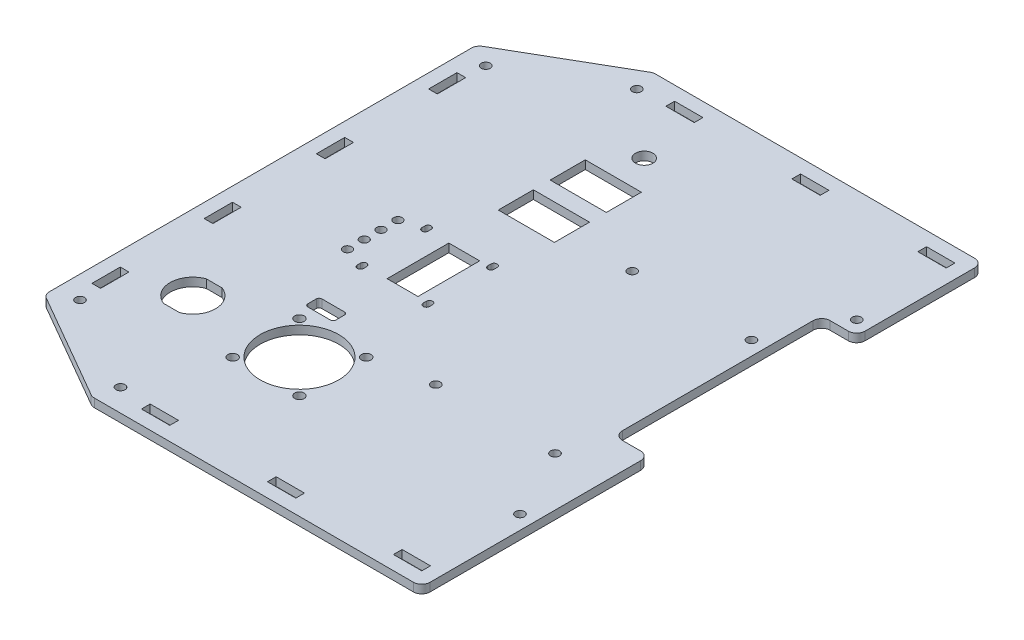
from build123d import *

# Parameters (mm, degrees)
SKETCH1_W           = 11
SKETCH1_H           = 22
BOSS_EXTRUDE1_DEPTH = 3
SKETCH5_R           = 1.6
CUT_EXTRUDE2_DEPTH  = 161.106214887
SKETCH6_W           = 10
SKETCH6_H           = 5
CUT_EXTRUDE3_DEPTH  = 161.106214887
FILLET2_R           = 1
SKETCH8_R           = 3.1
SKETCH8_W           = 20
SKETCH8_H           = 12.5
CUT_EXTRUDE5_DEPTH  = 161.106214887
CUT_EXTRUDE8_DEPTH  = 161.106214887
SKETCH12_R          = 1.55
CUT_EXTRUDE9_DEPTH  = 161.106214887
CUT_EXTRUDE10_REACH = 162.106
SKETCH13_R          = 1.6
SKETCH14_W          = 3.1
SKETCH14_H          = 10.1
CUT_EXTRUDE11_DEPTH = 161.106214887
SKETCH15_W          = 12.5
SKETCH15_H          = 74
CUT_EXTRUDE12_DEPTH = 161.106214887
FILLET3_R           = 3
SKETCH16_W          = 10.1
SKETCH16_H          = 3.1
CUT_EXTRUDE13_DEPTH = 161.106214887


with BuildPart() as part:
    # Sketch1 → Boss-Extrude1 (new body)
    with BuildSketch(Plane(origin=(0, 0, 0), x_dir=(1, 0, 0), z_dir=(0, 1, 0))):
        Polygon((32.5, -100), (32.5, 100), (-85, 100), (-125, 76.905989232), (-125, -76.905989232), (-85, -100), align=None)
        with BuildLine():
            add(Edge.make_bspline(
                [(-50.0260005, -38.958999214), (-50.026000351, -42.358999214), (-46.626000351, -42.358999065), (-46.6260005, -38.958999065), (-46.626000649, -35.558999065), (-50.026000649, -35.558999214), (-50.0260005, -38.958999214)],
                knots=[0, 0, 0, 0, 0.5, 0.5, 0.5, 1, 1, 1, 1], degree=3, weights=[1, 0.333333333, 0.333333333, 1, 0.333333333, 0.333333333, 1]))
        make_face(mode=Mode.SUBTRACT)
        with BuildLine():
            add(Edge.make_bspline(
                [(-50.02599946, -62.758999214), (-50.025999311, -66.158999214), (-46.625999311, -66.158999065), (-46.62599946, -62.758999065), (-46.625999608, -59.358999065), (-50.025999608, -59.358999214), (-50.02599946, -62.758999214)],
                knots=[0, 0, 0, 0, 0.5, 0.5, 0.5, 1, 1, 1, 1], degree=3, weights=[1, 0.333333333, 0.333333333, 1, 0.333333333, 0.333333333, 1]))
        make_face(mode=Mode.SUBTRACT)
        with BuildLine():
            add(Edge.make_bspline(
                [(-73.82599946, -62.759000254), (-73.825999311, -66.159000254), (-70.425999311, -66.159000106), (-70.42599946, -62.759000106), (-70.425999608, -59.359000106), (-73.825999608, -59.359000254), (-73.82599946, -62.759000254)],
                knots=[0, 0, 0, 0, 0.5, 0.5, 0.5, 1, 1, 1, 1], degree=3, weights=[1, 0.333333333, 0.333333333, 1, 0.333333333, 0.333333333, 1]))
        make_face(mode=Mode.SUBTRACT)
        with BuildLine():
            add(Edge.make_bspline(
                [(-73.8260005, -38.959000254), (-73.826000351, -42.359000254), (-70.426000351, -42.359000106), (-70.4260005, -38.959000106), (-70.426000649, -35.559000106), (-73.826000649, -35.559000254), (-73.8260005, -38.959000254)],
                knots=[0, 0, 0, 0, 0.5, 0.5, 0.5, 1, 1, 1, 1], degree=3, weights=[1, 0.333333333, 0.333333333, 1, 0.333333333, 0.333333333, 1]))
        make_face(mode=Mode.SUBTRACT)
        with Locations((-63.350999836, 0)):
            Rectangle(SKETCH1_W, SKETCH1_H, mode=Mode.SUBTRACT)
        with BuildLine():
            Line((-76.200999836, -12.05), (-76.200999836, -10.95))
            ThreePointArc((-76.200999836, -10.95), (-77.300999836, -9.85), (-78.400999836, -10.95))
            Line((-78.400999836, -10.95), (-78.400999836, -12.05))
            ThreePointArc((-78.400999836, -12.05), (-77.300999836, -13.15), (-76.200999836, -12.05))
        make_face(mode=Mode.SUBTRACT)
        with BuildLine():
            Line((-54.900999836, -10.95), (-54.900999836, -12.05))
            ThreePointArc((-54.900999836, -12.05), (-53.800999836, -13.15), (-52.700999836, -12.05))
            Line((-52.700999836, -12.05), (-52.700999836, -10.95))
            ThreePointArc((-52.700999836, -10.95), (-53.800999836, -9.85), (-54.900999836, -10.95))
        make_face(mode=Mode.SUBTRACT)
        with BuildLine():
            Line((-52.700999836, 10.95), (-52.700999836, 12.05))
            ThreePointArc((-52.700999836, 12.05), (-53.800999836, 13.15), (-54.900999836, 12.05))
            Line((-54.900999836, 12.05), (-54.900999836, 10.95))
            ThreePointArc((-54.900999836, 10.95), (-53.800999836, 9.85), (-52.700999836, 10.95))
        make_face(mode=Mode.SUBTRACT)
        with BuildLine():
            Line((-76.200999836, 10.95), (-76.200999836, 12.05))
            ThreePointArc((-76.200999836, 12.05), (-77.300999836, 13.15), (-78.400999836, 12.05))
            Line((-78.400999836, 12.05), (-78.400999836, 10.95))
            ThreePointArc((-78.400999836, 10.95), (-77.300999836, 9.85), (-76.200999836, 10.95))
        make_face(mode=Mode.SUBTRACT)
        with BuildLine():
            add(Edge.make_bspline(
                [(-72.862872761, -56.884731674), (-73.764033973, -54.99486011), (-74.225999888, -52.95273045), (-74.22599998, -50.859000272)],
                knots=[0, 0, 0, 0, 1, 1, 1, 1], degree=3, weights=[1, 0.983569835, 0.983569835, 1]))
            add(Edge.make_bspline(
                [(-74.22599998, -50.859000272), (-74.226000316, -43.160577264), (-69.000623793, -37.507157325), (-61.32600059, -36.902280929)],
                knots=[0, 0, 0, 0, 1, 1, 1, 1], degree=3, weights=[1, 0.822907168, 0.822907168, 1]))
            add(Edge.make_bspline(
                [(-59.12600059, -36.902280832), (-59.858576662, -36.844542818), (-60.593424523, -36.84454285), (-61.32600059, -36.902280929)],
                knots=[0, 0, 0, 0, 1, 1, 1, 1], degree=3, weights=[1, 0.997938991, 0.997938991, 1]))
            add(Edge.make_bspline(
                [(-59.12600059, -36.902280832), (-48.341925174, -37.752228162), (-42.933165825, -47.120473215), (-47.589126672, -56.884730602)],
                knots=[0, 0, 0, 0, 1, 1, 1, 1], degree=3, weights=[1, 0.710999398, 0.710999398, 1]))
            add(Edge.make_bspline(
                [(-48.689126588, -58.789986506), (-48.272835965, -58.184426057), (-47.905412062, -57.548029125), (-47.589126672, -56.884730602)],
                knots=[0, 0, 0, 0, 1, 1, 1, 1], degree=3, weights=[1, 0.997938991, 0.997938991, 1]))
            add(Edge.make_bspline(
                [(-48.689126588, -58.789986506), (-54.817240303, -67.704296091), (-65.634758183, -67.704296564), (-71.762872678, -58.789987547)],
                knots=[0, 0, 0, 0, 1, 1, 1, 1], degree=3, weights=[1, 0.710999398, 0.710999398, 1]))
            add(Edge.make_bspline(
                [(-72.862872761, -56.884731674), (-72.546587312, -57.548030202), (-72.179163354, -58.184427102), (-71.762872678, -58.789987547)],
                knots=[0, 0, 0, 0, 0.999999975, 0.999999975, 0.999999975, 0.999999975], degree=3, weights=[1, 0.997938991, 0.997938991, 1]))
        make_face(mode=Mode.SUBTRACT)
    extrude(amount=BOSS_EXTRUDE1_DEPTH)

    # Sketch5 → Cut-Extrude2 (cut, through all)
    with BuildSketch(Plane(origin=(0, 3, 0), x_dir=(1, 0, 0), z_dir=(0, 1, 0))):
        with Locations(Location((-27.5, 35, 0), (0, 0, 270))):
            Circle(SKETCH5_R)
        with Locations(Location((15, 35, 0), (0, 0, 270))):
            Circle(SKETCH5_R)
        with Locations(Location((-27.5, -35, 0), (0, 0, 270))):
            Circle(SKETCH5_R)
        with Locations(Location((15, -35, 0), (0, 0, 270))):
            Circle(SKETCH5_R)
    extrude(amount=-CUT_EXTRUDE2_DEPTH, mode=Mode.SUBTRACT)

    # Sketch6 → Cut-Extrude3 (cut, through all)
    with BuildSketch(Plane(origin=(0, 3, 0), x_dir=(1, 0, 0), z_dir=(0, 1, 0))):
        with Locations((-70.22599998, -31.35899966)):
            Rectangle(SKETCH6_W, SKETCH6_H)
    extrude(amount=-CUT_EXTRUDE3_DEPTH, mode=Mode.SUBTRACT)

    # Fillet2
    fillet2_edges = [part.edges().sort_by_distance(p)[0] for p in [
        (-75.22599998, 1.5, 33.85899966),
        (-75.22599998, 1.5, 28.85899966),
        (-65.22599998, 1.5, 28.85899966),
        (-65.22599998, 1.5, 33.85899966),
    ]]
    fillet(fillet2_edges, radius=FILLET2_R)

    # Sketch8 → Cut-Extrude5 (cut, through all)
    with BuildSketch(Plane(origin=(0, 3, 0), x_dir=(1, 0, 0), z_dir=(0, 1, 0))):
        with Locations(Location((-60.22599998, 72, 0), (0, 0, 270))):
            Circle(SKETCH8_R)
        with Locations((-60.22599998, 36.25)):
            Rectangle(SKETCH8_W, SKETCH8_H)
        with Locations((-60.22599998, 54.75)):
            Rectangle(SKETCH8_W, SKETCH8_H)
    extrude(amount=-CUT_EXTRUDE5_DEPTH, mode=Mode.SUBTRACT)

    # Sketch11 → Cut-Extrude8 (cut, through all)
    with BuildSketch(Plane(origin=(0, 3, 0), x_dir=(1, 0, 0), z_dir=(0, 1, 0))):
        with BuildLine():
            Line((-95.424214835, -43.25899966), (-101.027785125, -43.25899966))
            ThreePointArc((-101.027785125, -43.25899966), (-106.32599998, -50.85899966), (-101.027785125, -58.45899966))
            Line((-101.027785125, -58.45899966), (-95.424214835, -58.45899966))
            ThreePointArc((-95.424214835, -58.45899966), (-91.581285551, -55.491252909), (-90.12599998, -50.85899966))
            ThreePointArc((-90.12599998, -50.85899966), (-91.581285551, -46.226746411), (-95.424214835, -43.25899966))
        make_face()
    extrude(amount=-CUT_EXTRUDE8_DEPTH, mode=Mode.SUBTRACT)

    # Sketch12 → Cut-Extrude9 (cut, through all)
    with BuildSketch(Plane(origin=(0, 3, 0), x_dir=(1, 0, 0), z_dir=(0, 1, 0))):
        with Locations(Location((-85, 9, 0), (0, 0, 270))):
            Circle(SKETCH12_R)
        with Locations(Location((-85, 3, 0), (0, 0, 270))):
            Circle(SKETCH12_R)
        with Locations(Location((-85, -3, 0), (0, 0, 270))):
            Circle(SKETCH12_R)
        with Locations(Location((-85, -9, 0), (0, 0, 270))):
            Circle(SKETCH12_R)
    extrude(amount=-CUT_EXTRUDE9_DEPTH, mode=Mode.SUBTRACT)

    # Sketch13 → Cut-Extrude10 (cut, up to next)
    with BuildSketch(Plane(origin=(0, 3, 0), x_dir=(1, 0, 0), z_dir=(0, 1, 0)), mode=Mode.PRIVATE) as cut_extrude10_sk1:
        with Locations(Location((27.5, 60, 0), (0, 0, 270))):
            Circle(SKETCH13_R)
    cut_extrude10_tool1 = extrude(cut_extrude10_sk1.sketch, amount=-CUT_EXTRUDE10_REACH, mode=Mode.PRIVATE) & part.part
    # Sketch13 → Cut-Extrude10 (cut, up to next)
    with BuildSketch(Plane(origin=(0, 3, 0), x_dir=(1, 0, 0), z_dir=(0, 1, 0)), mode=Mode.PRIVATE) as cut_extrude10_sk2:
        with Locations(Location((27.5, -60, 0), (0, 0, 270))):
            Circle(SKETCH13_R)
    cut_extrude10_tool2 = extrude(cut_extrude10_sk2.sketch, amount=-CUT_EXTRUDE10_REACH, mode=Mode.PRIVATE) & part.part
    # Sketch13 → Cut-Extrude10 (cut, up to next)
    with BuildSketch(Plane(origin=(0, 3, 0), x_dir=(1, 0, 0), z_dir=(0, 1, 0)), mode=Mode.PRIVATE) as cut_extrude10_sk3:
        with Locations(Location((-82.856406461, -92, 0), (0, 0, 270))):
            Circle(SKETCH13_R)
    cut_extrude10_tool3 = extrude(cut_extrude10_sk3.sketch, amount=-CUT_EXTRUDE10_REACH, mode=Mode.PRIVATE) & part.part
    # Sketch13 → Cut-Extrude10 (cut, up to next)
    with BuildSketch(Plane(origin=(0, 3, 0), x_dir=(1, 0, 0), z_dir=(0, 1, 0)), mode=Mode.PRIVATE) as cut_extrude10_sk4:
        with Locations(Location((-117, -72.287187079, 0), (0, 0, 270))):
            Circle(SKETCH13_R)
    cut_extrude10_tool4 = extrude(cut_extrude10_sk4.sketch, amount=-CUT_EXTRUDE10_REACH, mode=Mode.PRIVATE) & part.part
    # Sketch13 → Cut-Extrude10 (cut, up to next)
    with BuildSketch(Plane(origin=(0, 3, 0), x_dir=(1, 0, 0), z_dir=(0, 1, 0)), mode=Mode.PRIVATE) as cut_extrude10_sk5:
        with Locations(Location((-117, 72.287187079, 0), (0, 0, 270))):
            Circle(SKETCH13_R)
    cut_extrude10_tool5 = extrude(cut_extrude10_sk5.sketch, amount=-CUT_EXTRUDE10_REACH, mode=Mode.PRIVATE) & part.part
    # Sketch13 → Cut-Extrude10 (cut, up to next)
    with BuildSketch(Plane(origin=(0, 3, 0), x_dir=(1, 0, 0), z_dir=(0, 1, 0)), mode=Mode.PRIVATE) as cut_extrude10_sk6:
        with Locations(Location((-82.856406461, 92, 0), (0, 0, 270))):
            Circle(SKETCH13_R)
    cut_extrude10_tool6 = extrude(cut_extrude10_sk6.sketch, amount=-CUT_EXTRUDE10_REACH, mode=Mode.PRIVATE) & part.part
    add(cut_extrude10_tool1.solids().sort_by_distance((27.5, 3, -60))[0], mode=Mode.SUBTRACT)
    add(cut_extrude10_tool2.solids().sort_by_distance((27.5, 3, 60))[0], mode=Mode.SUBTRACT)
    add(cut_extrude10_tool3.solids().sort_by_distance((-82.856406, 3, 92))[0], mode=Mode.SUBTRACT)
    add(cut_extrude10_tool4.solids().sort_by_distance((-117, 3, 72.287187))[0], mode=Mode.SUBTRACT)
    add(cut_extrude10_tool5.solids().sort_by_distance((-117, 3, -72.287187))[0], mode=Mode.SUBTRACT)
    add(cut_extrude10_tool6.solids().sort_by_distance((-82.856406, 3, -92))[0], mode=Mode.SUBTRACT)

    # Sketch14 → Cut-Extrude11 (cut, through all)
    with BuildSketch(Plane(origin=(0, 3, 0), x_dir=(1, 0, 0), z_dir=(0, 1, 0))):
        with Locations((-118.45, 60)):
            Rectangle(SKETCH14_W, SKETCH14_H)
        with Locations((-118.45, 20)):
            Rectangle(SKETCH14_W, SKETCH14_H)
        with Locations((-118.45, -20)):
            Rectangle(SKETCH14_W, SKETCH14_H)
        with Locations((-118.45, -60)):
            Rectangle(SKETCH14_W, SKETCH14_H)
    extrude(amount=-CUT_EXTRUDE11_DEPTH, mode=Mode.SUBTRACT)

    # Sketch15 → Cut-Extrude12 (cut, through all)
    with BuildSketch(Plane(origin=(0, 3, 0), x_dir=(1, 0, 0), z_dir=(0, 1, 0))):
        with Locations((26.25, 18)):
            Rectangle(SKETCH15_W, SKETCH15_H)
    extrude(amount=-CUT_EXTRUDE12_DEPTH, mode=Mode.SUBTRACT)

    # Fillet3
    fillet3_edges = [part.edges().sort_by_distance(p)[0] for p in [
        (32.5, 1.5, -100),
        (32.5, 1.5, 100),
        (-85, 1.5, 100),
        (-125, 1.5, 76.905989232),
        (-125, 1.5, -76.905989232),
        (-85, 1.5, -100),
        (32.5, 1.5, -55),
        (32.5, 1.5, 19),
        (20, 1.5, 19),
        (20, 1.5, -55),
    ]]
    fillet(fillet3_edges, radius=FILLET3_R)

    # Sketch16 → Cut-Extrude13 (cut, through all)
    with BuildSketch(Plane(origin=(0, 3, 0), x_dir=(1, 0, 0), z_dir=(0, 1, 0))):
        with Locations((22.45, -93.45)):
            Rectangle(SKETCH16_W, SKETCH16_H)
        with Locations((-22.45, -93.45)):
            Rectangle(SKETCH16_W, SKETCH16_H)
        with Locations((-67.35, -93.45)):
            Rectangle(SKETCH16_W, SKETCH16_H)
        with Locations((22.45, 93.45)):
            Rectangle(SKETCH16_W, SKETCH16_H)
        with Locations((-22.45, 93.45)):
            Rectangle(SKETCH16_W, SKETCH16_H)
        with Locations((-67.35, 93.45)):
            Rectangle(SKETCH16_W, SKETCH16_H)
    extrude(amount=-CUT_EXTRUDE13_DEPTH, mode=Mode.SUBTRACT)


solid = part.part
